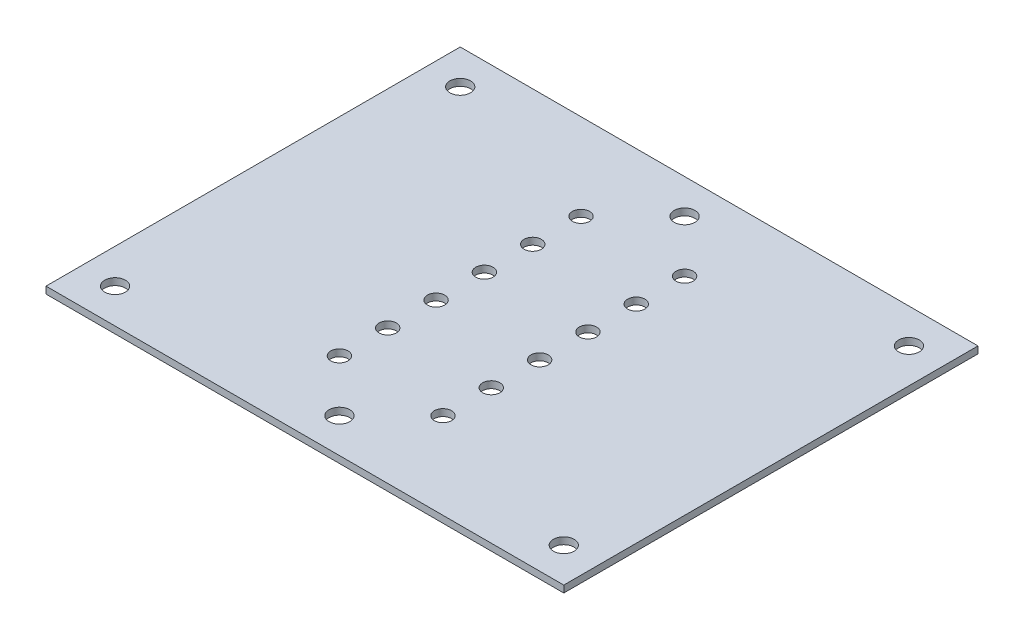
from build123d import *

# Parameters (mm, degrees)
SKETCH_1_W          = 75
SKETCH_1_H          = 60
EXTRUDE_1_DEPTH     = 1
SKETCH_2_R          = 1.25
CUT_EXTRUDE_1_DEPTH = 49.033842236
SKETCH_3_R          = 1.5
CUT_EXTRUDE_2_DEPTH = 49.033842236


with BuildPart() as part:
    # 草图1 → 凸台-拉伸1 (new body)
    with BuildSketch(Plane(origin=(0, 0, 0), x_dir=(1, 0, 0), z_dir=(0, 1, 0))):
        Rectangle(SKETCH_1_W, SKETCH_1_H)
    extrude(amount=EXTRUDE_1_DEPTH)

    # 草图2 → 切除-拉伸1 (cut, through all)
    with BuildSketch(Plane(origin=(0, 0, 0), x_dir=(1, 0, 0), z_dir=(0, 1, 0))):
        with Locations(Location((-7.5, 17.5, 0), (0, 0, 270))):
            Circle(SKETCH_2_R)
        with Locations(Location((7.5, 17.5, 0), (0, 0, 270))):
            Circle(SKETCH_2_R)
        with Locations(Location((7.5, 10.5, 0), (0, 0, 270))):
            Circle(SKETCH_2_R)
        with Locations(Location((7.5, 3.5, 0), (0, 0, 270))):
            Circle(SKETCH_2_R)
        with Locations(Location((7.5, -3.5, 0), (0, 0, 270))):
            Circle(SKETCH_2_R)
        with Locations(Location((7.5, -10.5, 0), (0, 0, 270))):
            Circle(SKETCH_2_R)
        with Locations(Location((7.5, -17.5, 0), (0, 0, 270))):
            Circle(SKETCH_2_R)
        with Locations(Location((-7.5, 10.5, 0), (0, 0, 270))):
            Circle(SKETCH_2_R)
        with Locations(Location((-7.5, 3.5, 0), (0, 0, 270))):
            Circle(SKETCH_2_R)
        with Locations(Location((-7.5, -3.5, 0), (0, 0, 270))):
            Circle(SKETCH_2_R)
        with Locations(Location((-7.5, -10.5, 0), (0, 0, 270))):
            Circle(SKETCH_2_R)
        with Locations(Location((-7.5, -17.5, 0), (0, 0, 270))):
            Circle(SKETCH_2_R)
    extrude(amount=CUT_EXTRUDE_1_DEPTH, mode=Mode.SUBTRACT)

    # 草图3 → 切除-拉伸2 (cut, through all)
    with BuildSketch(Plane(origin=(0, 0, 0), x_dir=(1, 0, 0), z_dir=(0, 1, 0))):
        with Locations(Location((-32.5, 25, 0), (0, 0, 270))):
            Circle(SKETCH_3_R)
        with Locations(Location((32.5, -25, 0), (0, 0, 270))):
            Circle(SKETCH_3_R)
        with Locations(Location((-32.5, -25, 0), (0, 0, 90))):
            Circle(SKETCH_3_R)
        with Locations(Location((32.5, 25, 0), (0, 0, 90))):
            Circle(SKETCH_3_R)
        with Locations(Location((0, -25, 0), (0, 0, 90))):
            Circle(SKETCH_3_R)
        with Locations(Location((0, 25, 0), (0, 0, 270))):
            Circle(SKETCH_3_R)
    extrude(amount=CUT_EXTRUDE_2_DEPTH, mode=Mode.SUBTRACT)


solid = part.part
